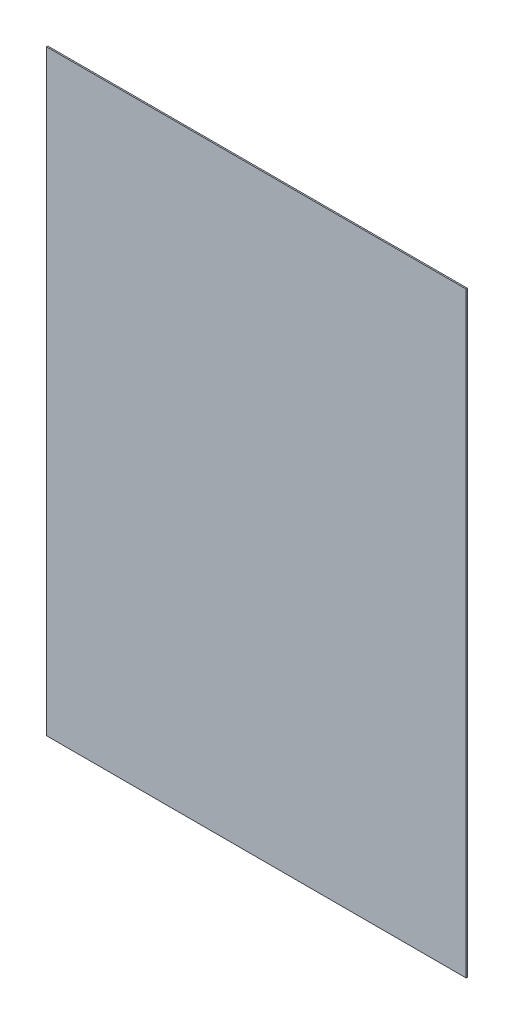
from build123d import *

# Parameters (mm, degrees)
CROQUIS1_W              = 914.3
CROQUIS1_H              = 1300
SALIENTE_EXTRUIR1_DEPTH = 2.9


with BuildPart() as part:
    # Croquis1 → Saliente-Extruir1 (new body)
    with BuildSketch(Plane.XY):
        with Locations((457.15, -650)):
            Rectangle(CROQUIS1_W, CROQUIS1_H)
    extrude(amount=SALIENTE_EXTRUIR1_DEPTH)


solid = part.part
